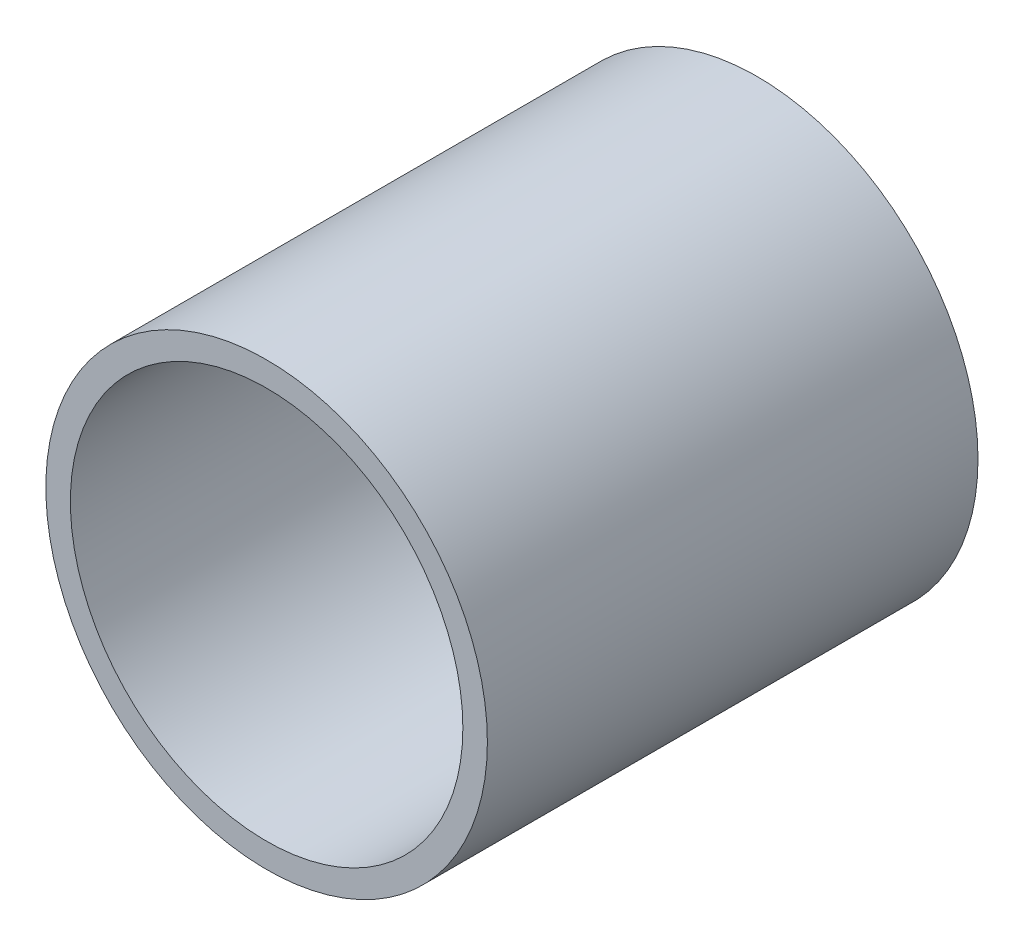
from build123d import *

# Parameters (mm, degrees)
IZIM2_R                     = 18
IZIM2_R_2                   = 16
Y_KSEKLIK_EKSTR_ZYON1_DEPTH = 40


with BuildPart() as part:
    # Çizim2 → Yükseklik-Ekstrüzyon1 (new body)
    with BuildSketch(Plane.XY):
        Circle(IZIM2_R)
        Circle(IZIM2_R_2, mode=Mode.SUBTRACT)
    extrude(amount=Y_KSEKLIK_EKSTR_ZYON1_DEPTH)


solid = part.part
